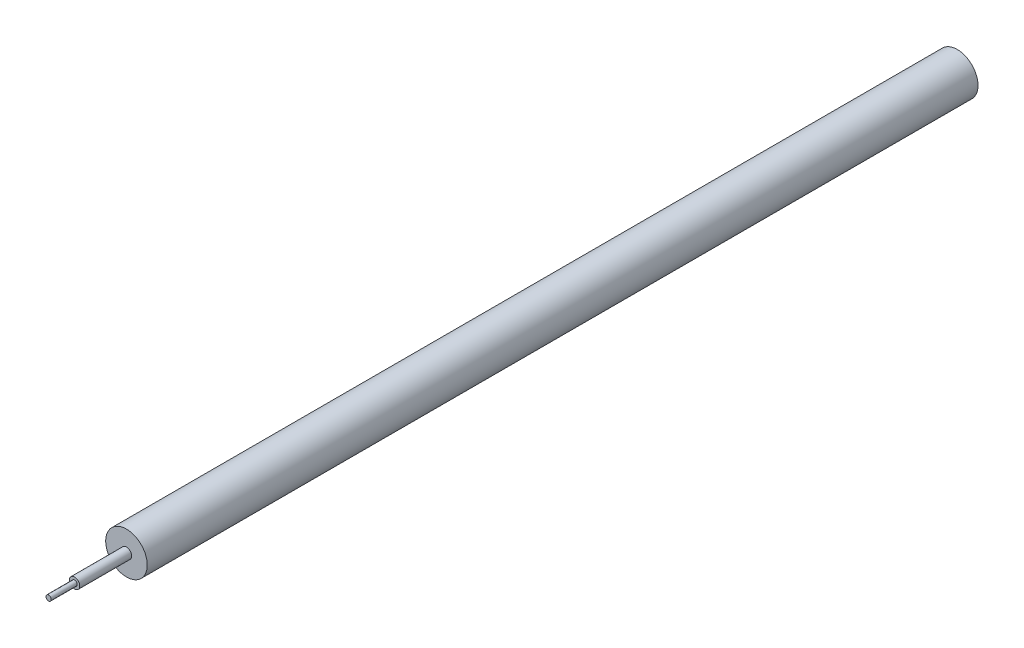
from build123d import *

# Parameters (mm, degrees)
SKETCH1_R           = 4
BOSS_EXTRUDE1_DEPTH = 160
SKETCH2_R           = 1
BOSS_EXTRUDE2_DEPTH = 10
SKETCH2_3_R         = 0.5
BOSS_EXTRUDE3_DEPTH = 15


with BuildPart() as part:
    # Sketch1 → Boss-Extrude1 (new body)
    with BuildSketch(Plane.XY):
        Circle(SKETCH1_R)
    extrude(amount=BOSS_EXTRUDE1_DEPTH)

    # Sketch2 → Boss-Extrude2 (add)
    with BuildSketch(Plane.XY.offset(160)):
        Circle(SKETCH2_R)
    extrude(amount=BOSS_EXTRUDE2_DEPTH)

    # Sketch2<3> → Boss-Extrude3 (add)
    with BuildSketch(Plane.XY.offset(160)):
        Circle(SKETCH2_3_R)
    extrude(amount=BOSS_EXTRUDE3_DEPTH)


solid = part.part
